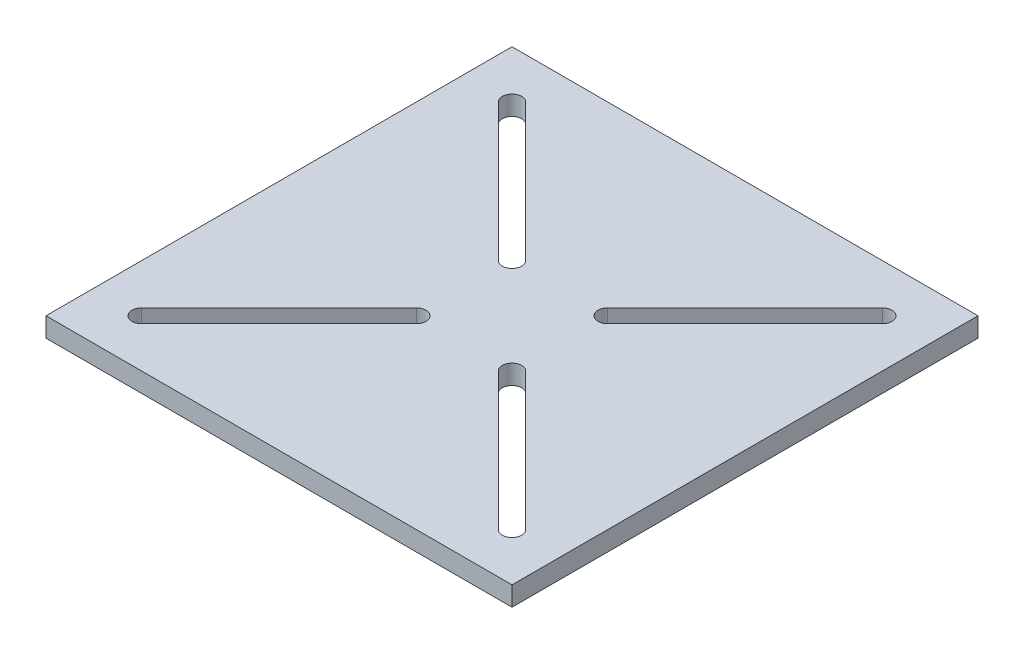
from build123d import *

# Parameters (mm, degrees)
SKETCH1_W           = 152.4
SKETCH1_H           = 152.4
BOSS_EXTRUDE1_DEPTH = 6.35


with BuildPart() as part:
    # Sketch1 → Boss-Extrude1 (new body)
    with BuildSketch(Plane(origin=(0, 0, 0), x_dir=(1, 0, 0), z_dir=(0, 1, 0))):
        with Locations((76.2, 76.2)):
            Rectangle(SKETCH1_W, SKETCH1_H)
        with BuildLine():
            Line((17.894423728, 138.995704333), (62.795704333, 94.094423728))
            ThreePointArc((62.795704333, 94.094423728), (62.795704333, 89.604295667), (58.305576272, 89.604295667))
            Line((58.305576272, 89.604295667), (13.404295667, 134.505576272))
            ThreePointArc((13.404295667, 134.505576272), (13.404295667, 138.995704333), (17.894423728, 138.995704333))
        make_face(mode=Mode.SUBTRACT)
        with BuildLine():
            Line((134.505576272, 138.995704333), (89.604295667, 94.094423728))
            ThreePointArc((89.604295667, 94.094423728), (89.604295667, 89.604295667), (94.094423728, 89.604295667))
            Line((94.094423728, 89.604295667), (138.995704333, 134.505576272))
            ThreePointArc((138.995704333, 134.505576272), (138.995704333, 138.995704333), (134.505576272, 138.995704333))
        make_face(mode=Mode.SUBTRACT)
        with BuildLine():
            Line((134.505576272, 13.404295667), (89.604295667, 58.305576272))
            ThreePointArc((89.604295667, 58.305576272), (89.604295667, 62.795704333), (94.094423728, 62.795704333))
            Line((94.094423728, 62.795704333), (138.995704333, 17.894423728))
            ThreePointArc((138.995704333, 17.894423728), (138.995704333, 13.404295667), (134.505576272, 13.404295667))
        make_face(mode=Mode.SUBTRACT)
        with BuildLine():
            Line((17.894423728, 13.404295667), (62.795704333, 58.305576272))
            ThreePointArc((62.795704333, 58.305576272), (62.795704333, 62.795704333), (58.305576272, 62.795704333))
            Line((58.305576272, 62.795704333), (13.404295667, 17.894423728))
            ThreePointArc((13.404295667, 17.894423728), (13.404295667, 13.404295667), (17.894423728, 13.404295667))
        make_face(mode=Mode.SUBTRACT)
    extrude(amount=BOSS_EXTRUDE1_DEPTH)


solid = part.part
